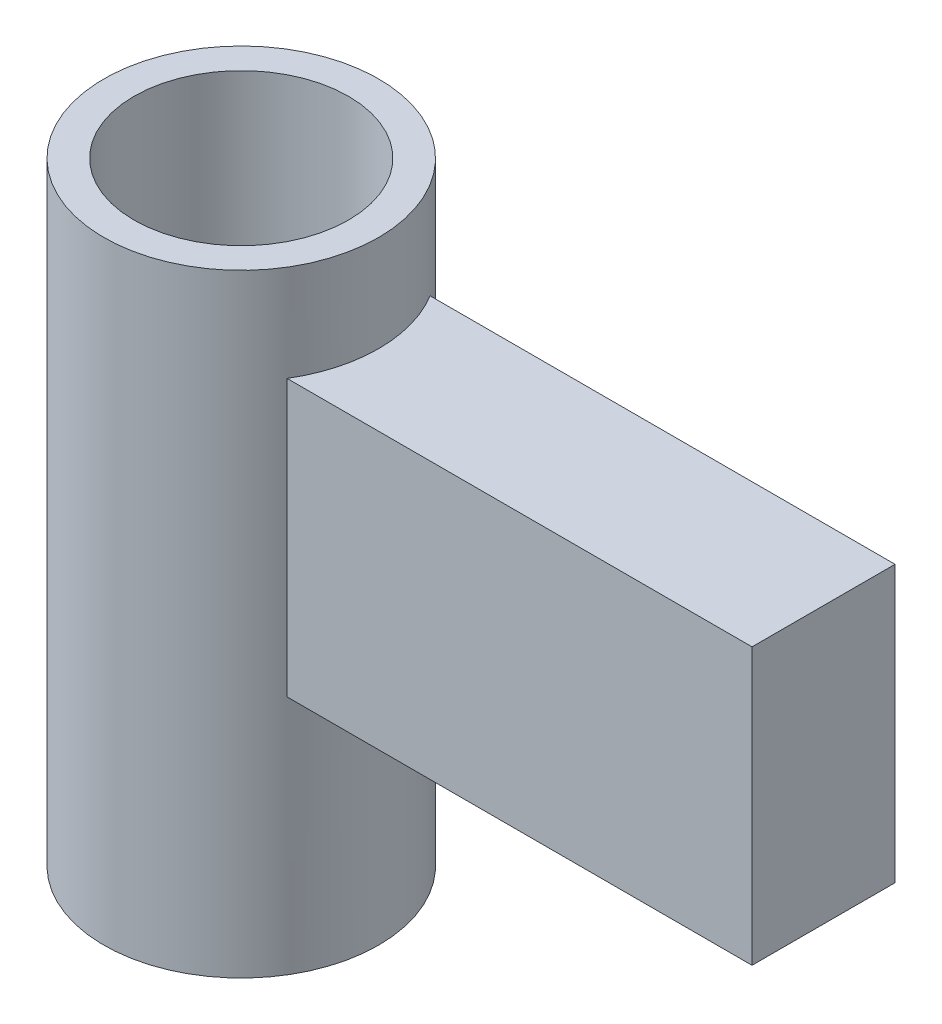
from build123d import *

# Parameters (mm, degrees)
SKETCH_1_R             = 13.45
SKETCH_1_R_2           = 10.5
EXTRUDE_1_DEPTH        = 60
EXTRUDE_1_2_DEPTH      = 47
EXTRUDE_1_2_DEPTH_BACK = 5
SKETCH_2_W             = 14
SKETCH_2_H             = 27


with BuildPart() as part:
    # 草圖1 → Extrude 1 (new body)
    with BuildSketch(Plane(origin=(0, 0, 0), x_dir=(1, 0, 0), z_dir=(0, 1, 0))):
        Circle(SKETCH_1_R)
        Circle(SKETCH_1_R_2, mode=Mode.SUBTRACT)
    extrude(amount=EXTRUDE_1_DEPTH)

    # 草圖2 → Extrude 1 2 (add, two sides: drawn at the far end of the back side and taken through both)
    with BuildSketch(Plane(origin=(10, 0, 0), x_dir=(0, 0, -1), z_dir=(1, 0, 0)).offset(-EXTRUDE_1_2_DEPTH_BACK)):
        with Locations((0, 37.071329062)):
            Rectangle(SKETCH_2_W, SKETCH_2_H)
    extrude(amount=EXTRUDE_1_2_DEPTH + EXTRUDE_1_2_DEPTH_BACK)


solid = part.part
